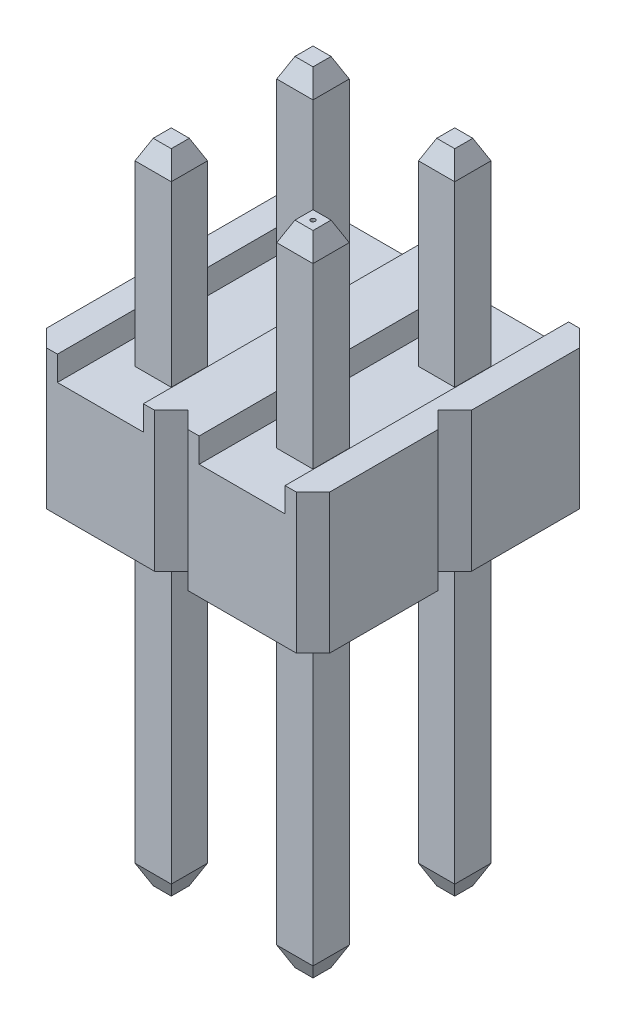
from build123d import *
from OCP.BRepFilletAPI import BRepFilletAPI_MakeChamfer

# Parameters (mm, degrees)
EXTRUDE1_DEPTH              = 2.5
SKETCH2_W                   = 1.54
SKETCH2_H                   = 0.508742985
CUT_EXTRUDE1_DEPTH          = 12.5
SKETCH3_W                   = 0.65
SKETCH3_H                   = 0.65
EXTRUDE2_DEPTH              = 3.54
CHAMFER1_SIZE               = 0.35
CHAMFER1_SIZE2              = 0.16320768
SKETCH4_W                   = 0.65
SKETCH4_H                   = 0.65
EXTRUDE3_DEPTH              = 6
CHAMFER2_SIZE               = 0.35
CHAMFER2_SIZE2              = 0.16320768
LPATTERN3_COUNT             = 2
LPATTERN3_PITCH             = 2.54
LPATTERN3_COUNT_DIR2        = 2
LPATTERN3_PITCH_DIR2        = 2.54
LPATTERN4_COUNT             = 2
LPATTERN4_PITCH             = 2.54
LPATTERN4_COUNT_DIR2        = 2
LPATTERN4_PITCH_DIR2        = 2.54
CHAMFER1_OF_LPATTERN4_SIZE  = 0.35
CHAMFER1_OF_LPATTERN4_SIZE2 = 0.16320768
CHAMFER2_OF_LPATTERN4_SIZE  = 0.35
CHAMFER2_OF_LPATTERN4_SIZE2 = 0.16320768
ESBO_O1_R                   = 0.039608668
CORTE_EXTRUS_O1_DEPTH       = 0.1


with BuildPart() as part:
    # Sketch1 → Extrude1 (new body)
    with BuildSketch(Plane(origin=(0, 0, 0), x_dir=(1, 0, 0), z_dir=(0, 1, 0))):
        Polygon((-0.97, 1.27), (0.97, 1.27), (1.27, 0.97), (1.27, -0.97), (0.97, -1.27), (-0.97, -1.27), (-1.27, -0.97), (-1.27, 0.97), align=None)
    extrude1 = extrude(amount=EXTRUDE1_DEPTH)

    # Sketch2 → Cut-Extrude1 (cut)
    with BuildSketch(Plane.XY.offset(1.27)):
        with Locations((0, 2.314371493)):
            Rectangle(SKETCH2_W, SKETCH2_H)
    cut_extrude1 = extrude(amount=-CUT_EXTRUDE1_DEPTH, mode=Mode.SUBTRACT)

    # Sketch3 → Extrude2 (add)
    with BuildSketch(Plane(origin=(0, 2.06, 0), x_dir=(-1, 0, 0), z_dir=(0, 1, 0))):
        Rectangle(SKETCH3_W, SKETCH3_H)
    extrude2 = extrude(amount=EXTRUDE2_DEPTH)

    # Chamfer1: one chamfer whose edges measure the first distance from different faces: ONE call of the kernel's chamfer builder (chamfer() names one face for all edges)
    chamfer1_edges_1 = [part.edges().sort_by_distance(p)[0] for p in [
        (-0.325, 5.6, 0),
    ]]
    chamfer1_side_1 = [part.faces().sort_by_distance(p)[0] for p in [
        (-0.325, 3.83, 0),
    ]]
    chamfer1_edges_2 = [part.edges().sort_by_distance(p)[0] for p in [
        (0, 5.6, 0.325),
    ]]
    chamfer1_side_2 = [part.faces().sort_by_distance(p)[0] for p in [
        (0, 3.83, 0.325),
    ]]
    chamfer1_edges_3 = [part.edges().sort_by_distance(p)[0] for p in [
        (0.325, 5.6, 0),
    ]]
    chamfer1_side_3 = [part.faces().sort_by_distance(p)[0] for p in [
        (0.325, 3.83, 0),
    ]]
    chamfer1_edges_4 = [part.edges().sort_by_distance(p)[0] for p in [
        (0, 5.6, -0.325),
    ]]
    chamfer1_side_4 = [part.faces().sort_by_distance(p)[0] for p in [
        (0, 3.83, -0.325),
    ]]
    chamfer1 = BRepFilletAPI_MakeChamfer(part.part.solid().wrapped)
    for e in chamfer1_edges_1:
        chamfer1.Add(CHAMFER1_SIZE, CHAMFER1_SIZE2, e.wrapped, chamfer1_side_1[0].wrapped)  # the first distance lies on this face
    for e in chamfer1_edges_2:
        chamfer1.Add(CHAMFER1_SIZE, CHAMFER1_SIZE2, e.wrapped, chamfer1_side_2[0].wrapped)  # the first distance lies on this face
    for e in chamfer1_edges_3:
        chamfer1.Add(CHAMFER1_SIZE, CHAMFER1_SIZE2, e.wrapped, chamfer1_side_3[0].wrapped)  # the first distance lies on this face
    for e in chamfer1_edges_4:
        chamfer1.Add(CHAMFER1_SIZE, CHAMFER1_SIZE2, e.wrapped, chamfer1_side_4[0].wrapped)  # the first distance lies on this face
    add(Compound.cast(chamfer1.Shape()), mode=Mode.REPLACE)

    # Sketch4 → Extrude3 (add)
    with BuildSketch(Plane.XZ):
        Rectangle(SKETCH4_W, SKETCH4_H)
    extrude3 = extrude(amount=EXTRUDE3_DEPTH)

    # Chamfer2: one chamfer whose edges measure the first distance from different faces: ONE call of the kernel's chamfer builder (chamfer() names one face for all edges)
    chamfer2_edges_1 = [part.edges().sort_by_distance(p)[0] for p in [
        (-0.325, -6, 0),
    ]]
    chamfer2_side_1 = [part.faces().sort_by_distance(p)[0] for p in [
        (-0.325, -3, 0),
    ]]
    chamfer2_edges_2 = [part.edges().sort_by_distance(p)[0] for p in [
        (0, -6, -0.325),
    ]]
    chamfer2_side_2 = [part.faces().sort_by_distance(p)[0] for p in [
        (0, -3, -0.325),
    ]]
    chamfer2_edges_3 = [part.edges().sort_by_distance(p)[0] for p in [
        (0.325, -6, 0),
    ]]
    chamfer2_side_3 = [part.faces().sort_by_distance(p)[0] for p in [
        (0.325, -3, 0),
    ]]
    chamfer2_edges_4 = [part.edges().sort_by_distance(p)[0] for p in [
        (0, -6, 0.325),
    ]]
    chamfer2_side_4 = [part.faces().sort_by_distance(p)[0] for p in [
        (0, -3, 0.325),
    ]]
    chamfer2 = BRepFilletAPI_MakeChamfer(part.part.solid().wrapped)
    for e in chamfer2_edges_1:
        chamfer2.Add(CHAMFER2_SIZE, CHAMFER2_SIZE2, e.wrapped, chamfer2_side_1[0].wrapped)  # the first distance lies on this face
    for e in chamfer2_edges_2:
        chamfer2.Add(CHAMFER2_SIZE, CHAMFER2_SIZE2, e.wrapped, chamfer2_side_2[0].wrapped)  # the first distance lies on this face
    for e in chamfer2_edges_3:
        chamfer2.Add(CHAMFER2_SIZE, CHAMFER2_SIZE2, e.wrapped, chamfer2_side_3[0].wrapped)  # the first distance lies on this face
    for e in chamfer2_edges_4:
        chamfer2.Add(CHAMFER2_SIZE, CHAMFER2_SIZE2, e.wrapped, chamfer2_side_4[0].wrapped)  # the first distance lies on this face
    add(Compound.cast(chamfer2.Shape()), mode=Mode.REPLACE)

    # LPattern3: Extrude1, Cut-Extrude1 2 × 2
    with Locations(*[(-j * LPATTERN3_PITCH_DIR2, 0, -i * LPATTERN3_PITCH) for i in range(LPATTERN3_COUNT) for j in range(LPATTERN3_COUNT_DIR2) if (i, j) != (0, 0)]):
        add(extrude1)
        add(cut_extrude1, mode=Mode.SUBTRACT)

    # LPattern4: Extrude2, Extrude3 2 × 2
    with Locations(*[(-j * LPATTERN4_PITCH_DIR2, 0, -i * LPATTERN4_PITCH) for i in range(LPATTERN4_COUNT) for j in range(LPATTERN4_COUNT_DIR2) if (i, j) != (0, 0)]):
        add(extrude2)
        add(extrude3)

    # Chamfer1 of LPattern4: one chamfer whose edges measure the first distance from different faces: ONE call of the kernel's chamfer builder (chamfer() names one face for all edges)
    chamfer1_of_lpattern4_edges_1 = [part.edges().sort_by_distance(p)[0] for p in [
        (-2.865, 5.6, 0),
    ]]
    chamfer1_of_lpattern4_side_1 = [part.faces().sort_by_distance(p)[0] for p in [
        (-2.865, 3.83, 0),
    ]]
    chamfer1_of_lpattern4_edges_2 = [part.edges().sort_by_distance(p)[0] for p in [
        (-2.54, 5.6, 0.325),
    ]]
    chamfer1_of_lpattern4_side_2 = [part.faces().sort_by_distance(p)[0] for p in [
        (-2.54, 3.83, 0.325),
    ]]
    chamfer1_of_lpattern4_edges_3 = [part.edges().sort_by_distance(p)[0] for p in [
        (-2.215, 5.6, 0),
    ]]
    chamfer1_of_lpattern4_side_3 = [part.faces().sort_by_distance(p)[0] for p in [
        (-2.215, 3.83, 0),
    ]]
    chamfer1_of_lpattern4_edges_4 = [part.edges().sort_by_distance(p)[0] for p in [
        (-2.54, 5.6, -0.325),
    ]]
    chamfer1_of_lpattern4_side_4 = [part.faces().sort_by_distance(p)[0] for p in [
        (-2.54, 3.83, -0.325),
    ]]
    chamfer1_of_lpattern4_edges_5 = [part.edges().sort_by_distance(p)[0] for p in [
        (-0.325, 5.6, -2.54),
    ]]
    chamfer1_of_lpattern4_side_5 = [part.faces().sort_by_distance(p)[0] for p in [
        (-0.325, 3.83, -2.54),
    ]]
    chamfer1_of_lpattern4_edges_6 = [part.edges().sort_by_distance(p)[0] for p in [
        (0, 5.6, -2.215),
    ]]
    chamfer1_of_lpattern4_side_6 = [part.faces().sort_by_distance(p)[0] for p in [
        (0, 3.83, -2.215),
    ]]
    chamfer1_of_lpattern4_edges_7 = [part.edges().sort_by_distance(p)[0] for p in [
        (0.325, 5.6, -2.54),
    ]]
    chamfer1_of_lpattern4_side_7 = [part.faces().sort_by_distance(p)[0] for p in [
        (0.325, 3.83, -2.54),
    ]]
    chamfer1_of_lpattern4_edges_8 = [part.edges().sort_by_distance(p)[0] for p in [
        (0, 5.6, -2.865),
    ]]
    chamfer1_of_lpattern4_side_8 = [part.faces().sort_by_distance(p)[0] for p in [
        (0, 3.83, -2.865),
    ]]
    chamfer1_of_lpattern4_edges_9 = [part.edges().sort_by_distance(p)[0] for p in [
        (-2.865, 5.6, -2.54),
    ]]
    chamfer1_of_lpattern4_side_9 = [part.faces().sort_by_distance(p)[0] for p in [
        (-2.865, 3.83, -2.54),
    ]]
    chamfer1_of_lpattern4_edges_10 = [part.edges().sort_by_distance(p)[0] for p in [
        (-2.54, 5.6, -2.215),
    ]]
    chamfer1_of_lpattern4_side_10 = [part.faces().sort_by_distance(p)[0] for p in [
        (-2.54, 3.83, -2.215),
    ]]
    chamfer1_of_lpattern4_edges_11 = [part.edges().sort_by_distance(p)[0] for p in [
        (-2.215, 5.6, -2.54),
    ]]
    chamfer1_of_lpattern4_side_11 = [part.faces().sort_by_distance(p)[0] for p in [
        (-2.215, 3.83, -2.54),
    ]]
    chamfer1_of_lpattern4_edges_12 = [part.edges().sort_by_distance(p)[0] for p in [
        (-2.54, 5.6, -2.865),
    ]]
    chamfer1_of_lpattern4_side_12 = [part.faces().sort_by_distance(p)[0] for p in [
        (-2.54, 3.83, -2.865),
    ]]
    chamfer1_of_lpattern4 = BRepFilletAPI_MakeChamfer(part.part.solid().wrapped)
    for e in chamfer1_of_lpattern4_edges_1:
        chamfer1_of_lpattern4.Add(CHAMFER1_OF_LPATTERN4_SIZE, CHAMFER1_OF_LPATTERN4_SIZE2, e.wrapped, chamfer1_of_lpattern4_side_1[0].wrapped)  # the first distance lies on this face
    for e in chamfer1_of_lpattern4_edges_2:
        chamfer1_of_lpattern4.Add(CHAMFER1_OF_LPATTERN4_SIZE, CHAMFER1_OF_LPATTERN4_SIZE2, e.wrapped, chamfer1_of_lpattern4_side_2[0].wrapped)  # the first distance lies on this face
    for e in chamfer1_of_lpattern4_edges_3:
        chamfer1_of_lpattern4.Add(CHAMFER1_OF_LPATTERN4_SIZE, CHAMFER1_OF_LPATTERN4_SIZE2, e.wrapped, chamfer1_of_lpattern4_side_3[0].wrapped)  # the first distance lies on this face
    for e in chamfer1_of_lpattern4_edges_4:
        chamfer1_of_lpattern4.Add(CHAMFER1_OF_LPATTERN4_SIZE, CHAMFER1_OF_LPATTERN4_SIZE2, e.wrapped, chamfer1_of_lpattern4_side_4[0].wrapped)  # the first distance lies on this face
    for e in chamfer1_of_lpattern4_edges_5:
        chamfer1_of_lpattern4.Add(CHAMFER1_OF_LPATTERN4_SIZE, CHAMFER1_OF_LPATTERN4_SIZE2, e.wrapped, chamfer1_of_lpattern4_side_5[0].wrapped)  # the first distance lies on this face
    for e in chamfer1_of_lpattern4_edges_6:
        chamfer1_of_lpattern4.Add(CHAMFER1_OF_LPATTERN4_SIZE, CHAMFER1_OF_LPATTERN4_SIZE2, e.wrapped, chamfer1_of_lpattern4_side_6[0].wrapped)  # the first distance lies on this face
    for e in chamfer1_of_lpattern4_edges_7:
        chamfer1_of_lpattern4.Add(CHAMFER1_OF_LPATTERN4_SIZE, CHAMFER1_OF_LPATTERN4_SIZE2, e.wrapped, chamfer1_of_lpattern4_side_7[0].wrapped)  # the first distance lies on this face
    for e in chamfer1_of_lpattern4_edges_8:
        chamfer1_of_lpattern4.Add(CHAMFER1_OF_LPATTERN4_SIZE, CHAMFER1_OF_LPATTERN4_SIZE2, e.wrapped, chamfer1_of_lpattern4_side_8[0].wrapped)  # the first distance lies on this face
    for e in chamfer1_of_lpattern4_edges_9:
        chamfer1_of_lpattern4.Add(CHAMFER1_OF_LPATTERN4_SIZE, CHAMFER1_OF_LPATTERN4_SIZE2, e.wrapped, chamfer1_of_lpattern4_side_9[0].wrapped)  # the first distance lies on this face
    for e in chamfer1_of_lpattern4_edges_10:
        chamfer1_of_lpattern4.Add(CHAMFER1_OF_LPATTERN4_SIZE, CHAMFER1_OF_LPATTERN4_SIZE2, e.wrapped, chamfer1_of_lpattern4_side_10[0].wrapped)  # the first distance lies on this face
    for e in chamfer1_of_lpattern4_edges_11:
        chamfer1_of_lpattern4.Add(CHAMFER1_OF_LPATTERN4_SIZE, CHAMFER1_OF_LPATTERN4_SIZE2, e.wrapped, chamfer1_of_lpattern4_side_11[0].wrapped)  # the first distance lies on this face
    for e in chamfer1_of_lpattern4_edges_12:
        chamfer1_of_lpattern4.Add(CHAMFER1_OF_LPATTERN4_SIZE, CHAMFER1_OF_LPATTERN4_SIZE2, e.wrapped, chamfer1_of_lpattern4_side_12[0].wrapped)  # the first distance lies on this face
    add(Compound.cast(chamfer1_of_lpattern4.Shape()), mode=Mode.REPLACE)

    # Chamfer2 of LPattern4: one chamfer whose edges measure the first distance from different faces: ONE call of the kernel's chamfer builder (chamfer() names one face for all edges)
    chamfer2_of_lpattern4_edges_1 = [part.edges().sort_by_distance(p)[0] for p in [
        (-2.865, -6, 0),
    ]]
    chamfer2_of_lpattern4_side_1 = [part.faces().sort_by_distance(p)[0] for p in [
        (-2.865, -3, 0),
    ]]
    chamfer2_of_lpattern4_edges_2 = [part.edges().sort_by_distance(p)[0] for p in [
        (-2.54, -6, -0.325),
    ]]
    chamfer2_of_lpattern4_side_2 = [part.faces().sort_by_distance(p)[0] for p in [
        (-2.54, -3, -0.325),
    ]]
    chamfer2_of_lpattern4_edges_3 = [part.edges().sort_by_distance(p)[0] for p in [
        (-2.215, -6, 0),
    ]]
    chamfer2_of_lpattern4_side_3 = [part.faces().sort_by_distance(p)[0] for p in [
        (-2.215, -3, 0),
    ]]
    chamfer2_of_lpattern4_edges_4 = [part.edges().sort_by_distance(p)[0] for p in [
        (-2.54, -6, 0.325),
    ]]
    chamfer2_of_lpattern4_side_4 = [part.faces().sort_by_distance(p)[0] for p in [
        (-2.54, -3, 0.325),
    ]]
    chamfer2_of_lpattern4_edges_5 = [part.edges().sort_by_distance(p)[0] for p in [
        (-0.325, -6, -2.54),
    ]]
    chamfer2_of_lpattern4_side_5 = [part.faces().sort_by_distance(p)[0] for p in [
        (-0.325, -3, -2.54),
    ]]
    chamfer2_of_lpattern4_edges_6 = [part.edges().sort_by_distance(p)[0] for p in [
        (0, -6, -2.865),
    ]]
    chamfer2_of_lpattern4_side_6 = [part.faces().sort_by_distance(p)[0] for p in [
        (0, -3, -2.865),
    ]]
    chamfer2_of_lpattern4_edges_7 = [part.edges().sort_by_distance(p)[0] for p in [
        (0.325, -6, -2.54),
    ]]
    chamfer2_of_lpattern4_side_7 = [part.faces().sort_by_distance(p)[0] for p in [
        (0.325, -3, -2.54),
    ]]
    chamfer2_of_lpattern4_edges_8 = [part.edges().sort_by_distance(p)[0] for p in [
        (0, -6, -2.215),
    ]]
    chamfer2_of_lpattern4_side_8 = [part.faces().sort_by_distance(p)[0] for p in [
        (0, -3, -2.215),
    ]]
    chamfer2_of_lpattern4_edges_9 = [part.edges().sort_by_distance(p)[0] for p in [
        (-2.865, -6, -2.54),
    ]]
    chamfer2_of_lpattern4_side_9 = [part.faces().sort_by_distance(p)[0] for p in [
        (-2.865, -3, -2.54),
    ]]
    chamfer2_of_lpattern4_edges_10 = [part.edges().sort_by_distance(p)[0] for p in [
        (-2.54, -6, -2.865),
    ]]
    chamfer2_of_lpattern4_side_10 = [part.faces().sort_by_distance(p)[0] for p in [
        (-2.54, -3, -2.865),
    ]]
    chamfer2_of_lpattern4_edges_11 = [part.edges().sort_by_distance(p)[0] for p in [
        (-2.215, -6, -2.54),
    ]]
    chamfer2_of_lpattern4_side_11 = [part.faces().sort_by_distance(p)[0] for p in [
        (-2.215, -3, -2.54),
    ]]
    chamfer2_of_lpattern4_edges_12 = [part.edges().sort_by_distance(p)[0] for p in [
        (-2.54, -6, -2.215),
    ]]
    chamfer2_of_lpattern4_side_12 = [part.faces().sort_by_distance(p)[0] for p in [
        (-2.54, -3, -2.215),
    ]]
    chamfer2_of_lpattern4 = BRepFilletAPI_MakeChamfer(part.part.solid().wrapped)
    for e in chamfer2_of_lpattern4_edges_1:
        chamfer2_of_lpattern4.Add(CHAMFER2_OF_LPATTERN4_SIZE, CHAMFER2_OF_LPATTERN4_SIZE2, e.wrapped, chamfer2_of_lpattern4_side_1[0].wrapped)  # the first distance lies on this face
    for e in chamfer2_of_lpattern4_edges_2:
        chamfer2_of_lpattern4.Add(CHAMFER2_OF_LPATTERN4_SIZE, CHAMFER2_OF_LPATTERN4_SIZE2, e.wrapped, chamfer2_of_lpattern4_side_2[0].wrapped)  # the first distance lies on this face
    for e in chamfer2_of_lpattern4_edges_3:
        chamfer2_of_lpattern4.Add(CHAMFER2_OF_LPATTERN4_SIZE, CHAMFER2_OF_LPATTERN4_SIZE2, e.wrapped, chamfer2_of_lpattern4_side_3[0].wrapped)  # the first distance lies on this face
    for e in chamfer2_of_lpattern4_edges_4:
        chamfer2_of_lpattern4.Add(CHAMFER2_OF_LPATTERN4_SIZE, CHAMFER2_OF_LPATTERN4_SIZE2, e.wrapped, chamfer2_of_lpattern4_side_4[0].wrapped)  # the first distance lies on this face
    for e in chamfer2_of_lpattern4_edges_5:
        chamfer2_of_lpattern4.Add(CHAMFER2_OF_LPATTERN4_SIZE, CHAMFER2_OF_LPATTERN4_SIZE2, e.wrapped, chamfer2_of_lpattern4_side_5[0].wrapped)  # the first distance lies on this face
    for e in chamfer2_of_lpattern4_edges_6:
        chamfer2_of_lpattern4.Add(CHAMFER2_OF_LPATTERN4_SIZE, CHAMFER2_OF_LPATTERN4_SIZE2, e.wrapped, chamfer2_of_lpattern4_side_6[0].wrapped)  # the first distance lies on this face
    for e in chamfer2_of_lpattern4_edges_7:
        chamfer2_of_lpattern4.Add(CHAMFER2_OF_LPATTERN4_SIZE, CHAMFER2_OF_LPATTERN4_SIZE2, e.wrapped, chamfer2_of_lpattern4_side_7[0].wrapped)  # the first distance lies on this face
    for e in chamfer2_of_lpattern4_edges_8:
        chamfer2_of_lpattern4.Add(CHAMFER2_OF_LPATTERN4_SIZE, CHAMFER2_OF_LPATTERN4_SIZE2, e.wrapped, chamfer2_of_lpattern4_side_8[0].wrapped)  # the first distance lies on this face
    for e in chamfer2_of_lpattern4_edges_9:
        chamfer2_of_lpattern4.Add(CHAMFER2_OF_LPATTERN4_SIZE, CHAMFER2_OF_LPATTERN4_SIZE2, e.wrapped, chamfer2_of_lpattern4_side_9[0].wrapped)  # the first distance lies on this face
    for e in chamfer2_of_lpattern4_edges_10:
        chamfer2_of_lpattern4.Add(CHAMFER2_OF_LPATTERN4_SIZE, CHAMFER2_OF_LPATTERN4_SIZE2, e.wrapped, chamfer2_of_lpattern4_side_10[0].wrapped)  # the first distance lies on this face
    for e in chamfer2_of_lpattern4_edges_11:
        chamfer2_of_lpattern4.Add(CHAMFER2_OF_LPATTERN4_SIZE, CHAMFER2_OF_LPATTERN4_SIZE2, e.wrapped, chamfer2_of_lpattern4_side_11[0].wrapped)  # the first distance lies on this face
    for e in chamfer2_of_lpattern4_edges_12:
        chamfer2_of_lpattern4.Add(CHAMFER2_OF_LPATTERN4_SIZE, CHAMFER2_OF_LPATTERN4_SIZE2, e.wrapped, chamfer2_of_lpattern4_side_12[0].wrapped)  # the first distance lies on this face
    add(Compound.cast(chamfer2_of_lpattern4.Shape()), mode=Mode.REPLACE)

    # Esboço1 → Corte-extrusão1 (cut)
    with BuildSketch(Plane(origin=(0, 5.6, 0), x_dir=(1, 0, 0), z_dir=(0, 1, 0))):
        with Locations(Location((0, 0, 0), (0, 0, 270))):
            Circle(ESBO_O1_R)
    extrude(amount=-CORTE_EXTRUS_O1_DEPTH, mode=Mode.SUBTRACT)


solid = part.part
